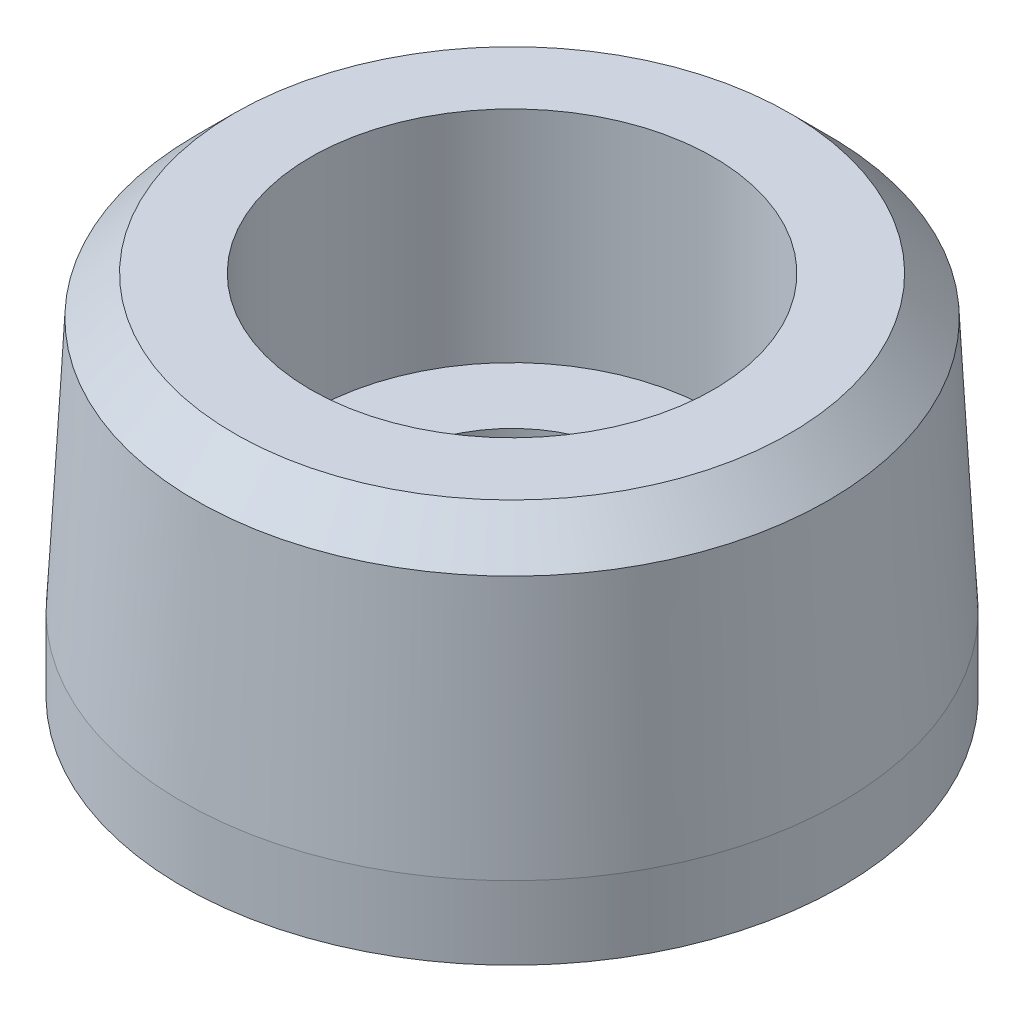
from build123d import *

# Parameters (mm, degrees)
HOLE_WIZARD_1_D           = 6.6
HOLE_WIZARD_1_CBORE_D     = 11
HOLE_WIZARD_1_CBORE_DEPTH = 6
CHAMFER_1_SIZE            = 1
CHAMFER_1_SIZE2           = 1.056754503


with BuildPart() as part:
    # 草图1 → 旋转1 (revolve)
    with BuildSketch(Plane.XY):
        Polygon((0, 0), (9, 0), (9, 2), (8.580737766, 10), (0, 10), align=None)
    revolve(axis=Axis((0, -1000, 0), (0, 1, 0)))

    # 打孔尺寸根据内六角圆柱头螺钉的类型1 (through all)
    with Locations(Plane(origin=(0, 10, 0), x_dir=(1, 0, 0), z_dir=(0, 1, 0))):
        with Locations((0, 0)):
            CounterBoreHole(HOLE_WIZARD_1_D / 2, HOLE_WIZARD_1_CBORE_D / 2, HOLE_WIZARD_1_CBORE_DEPTH)

    # 倒角1
    chamfer_1_edges = [part.edges().sort_by_distance(p)[0] for p in [
        (-8.580737766, 10, 0),
    ]]
    chamfer_1_side = [part.faces().sort_by_distance(p)[0] for p in [
        (-8.338037851, 10, 0),
    ]]
    chamfer(chamfer_1_edges, length=CHAMFER_1_SIZE, length2=CHAMFER_1_SIZE2, reference=chamfer_1_side[0])


solid = part.part
